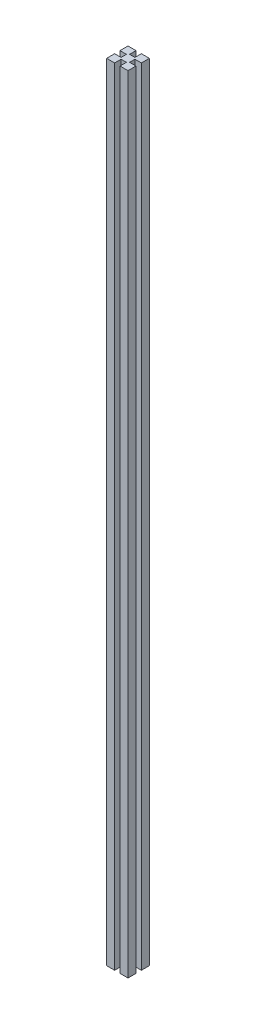
from build123d import *

# Parameters (mm, degrees)
BOSS_EXTRUDE1_DEPTH      = 368.3
BOSS_EXTRUDE1_DEPTH_BACK = 368.3
SKETCH1_W                = 20
SKETCH1_H                = 20
CUT_EXTRUDE1_DEPTH       = 369.571417774
CUT_EXTRUDE1_DEPTH_BACK  = 369.571417774
SKETCH2_W                = 5
SKETCH2_H                = 12
SKETCH2_W_2              = 12
SKETCH2_H_2              = 5


with BuildPart() as part:
    # Sketch1 → Boss-Extrude1 (new, two sides: drawn at the far end of the back side and taken through both)
    with BuildSketch(Plane(origin=(0, 0, 0), x_dir=(1, 0, 0), z_dir=(0, 1, 0)).offset(-BOSS_EXTRUDE1_DEPTH_BACK)):
        Rectangle(SKETCH1_W, SKETCH1_H)
    extrude(amount=BOSS_EXTRUDE1_DEPTH + BOSS_EXTRUDE1_DEPTH_BACK)

    # Sketch2 → Cut-Extrude1 (cut, two sides: drawn at the far end of the back side and taken through both)
    with BuildSketch(Plane(origin=(0, 0, 0), x_dir=(1, 0, 0), z_dir=(0, 1, 0)).offset(-CUT_EXTRUDE1_DEPTH_BACK)):
        with Locations((0, 10)):
            Rectangle(SKETCH2_W, SKETCH2_H)
        with Locations((10, 0)):
            Rectangle(SKETCH2_W_2, SKETCH2_H_2)
        with Locations((-10, 0)):
            Rectangle(SKETCH2_W_2, SKETCH2_H_2)
        with Locations((0, -10)):
            Rectangle(SKETCH2_W, SKETCH2_H)
    extrude(amount=CUT_EXTRUDE1_DEPTH + CUT_EXTRUDE1_DEPTH_BACK, mode=Mode.SUBTRACT)


solid = part.part
